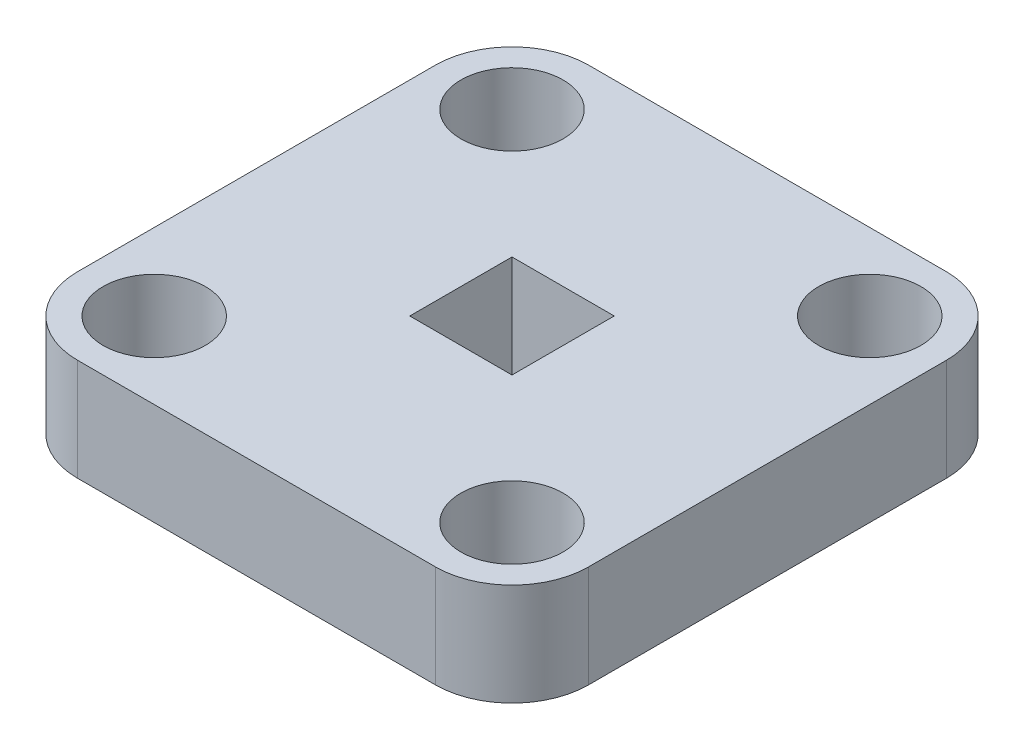
from build123d import *

# Parameters (mm, degrees)
SKETCH2_W           = 20
SKETCH2_H           = 20
SKETCH2_R           = 2
SKETCH2_W_2         = 4
SKETCH2_H_2         = 4
BOSS_EXTRUDE1_DEPTH = 4
FILLET3_R           = 3


with BuildPart() as part:
    # Sketch2 → Boss-Extrude1 (new body)
    with BuildSketch(Plane(origin=(0, 0, 0), x_dir=(1, 0, 0), z_dir=(0, 1, 0))):
        Rectangle(SKETCH2_W, SKETCH2_H)
        with Locations(Location((-7, 7, 0), (0, 0, 270))):
            Circle(SKETCH2_R, mode=Mode.SUBTRACT)
        with Locations(Location((7, 7, 0), (0, 0, 270))):
            Circle(SKETCH2_R, mode=Mode.SUBTRACT)
        with Locations(Location((7, -7, 0), (0, 0, 270))):
            Circle(SKETCH2_R, mode=Mode.SUBTRACT)
        with Locations(Location((-7, -7, 0), (0, 0, 270))):
            Circle(SKETCH2_R, mode=Mode.SUBTRACT)
        Rectangle(SKETCH2_W_2, SKETCH2_H_2, mode=Mode.SUBTRACT)
    extrude(amount=BOSS_EXTRUDE1_DEPTH)

    # Fillet3
    fillet3_edges = [part.edges().sort_by_distance(p)[0] for p in [
        (-10, 2, -10),
        (10, 2, -10),
        (10, 2, 10),
        (-10, 2, 10),
    ]]
    fillet(fillet3_edges, radius=FILLET3_R)


solid = part.part
